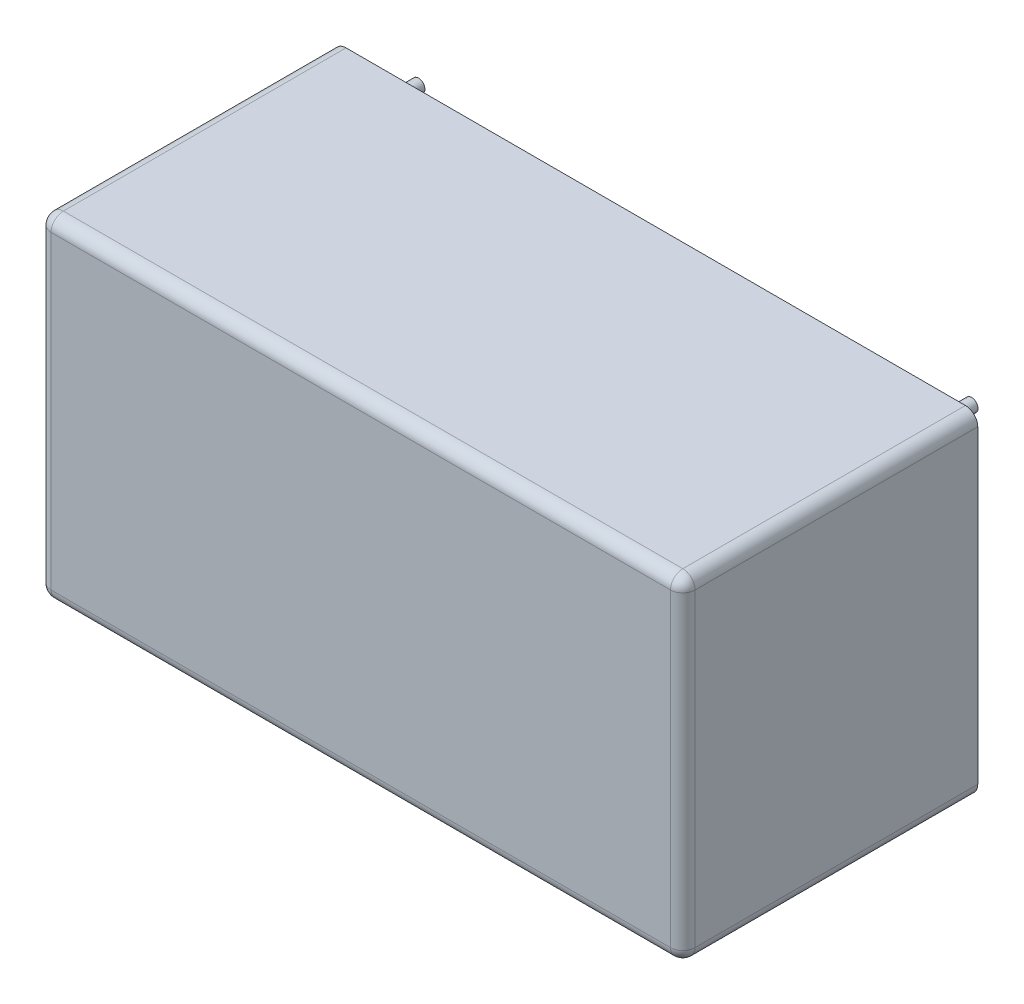
from build123d import *

# Parameters (mm, degrees)
BOSS_EXTRU_1_DEPTH = 24
CONG_1_R           = 1
ESQUISSE1_3_R      = 0.52
BOSS_EXTRU_2_DEPTH = 3.5


with BuildPart() as part:
    # Esquisse1 → Boss.-Extru.1 (new body)
    with BuildSketch(Plane.XY):
        with BuildLine():
            Line((-25.2, 13.6), (25.2, 13.6))
            ThreePointArc((25.2, 13.6), (25.907106781, 13.307106781), (26.2, 12.6))
            Line((26.2, 12.6), (26.2, -12.6))
            ThreePointArc((26.2, -12.6), (25.907106781, -13.307106781), (25.2, -13.6))
            Line((25.2, -13.6), (-25.2, -13.6))
            ThreePointArc((-25.2, -13.6), (-25.907106781, -13.307106781), (-26.2, -12.6))
            Line((-26.2, -12.6), (-26.2, 12.6))
            ThreePointArc((-26.2, 12.6), (-25.907106781, 13.307106781), (-25.2, 13.6))
        make_face()
    extrude(amount=BOSS_EXTRU_1_DEPTH)

    # Congé1
    cong_1_edges = [part.edges().sort_by_distance(p)[0] for p in [
        (0, 13.6, 24),
        (25.907106781, 13.307106781, 24),
        (26.2, 0, 24),
        (25.907106781, -13.307106781, 24),
        (0, -13.6, 24),
        (-25.907106781, -13.307106781, 24),
        (-26.2, 0, 24),
        (-25.907106781, 13.307106781, 24),
    ]]
    fillet(cong_1_edges, radius=CONG_1_R)

    # Esquisse1<3> → Boss.-Extru.2 (add)
    with BuildSketch(Plane.XY):
        with Locations((-22.8, 10.4)):
            Circle(ESQUISSE1_3_R)
        with Locations((-22.8, -10.4)):
            Circle(ESQUISSE1_3_R)
        with Locations((22.2, 10.4)):
            Circle(ESQUISSE1_3_R)
        with Locations((22.2, 2.4)):
            Circle(ESQUISSE1_3_R)
    extrude(amount=-BOSS_EXTRU_2_DEPTH)


solid = part.part
